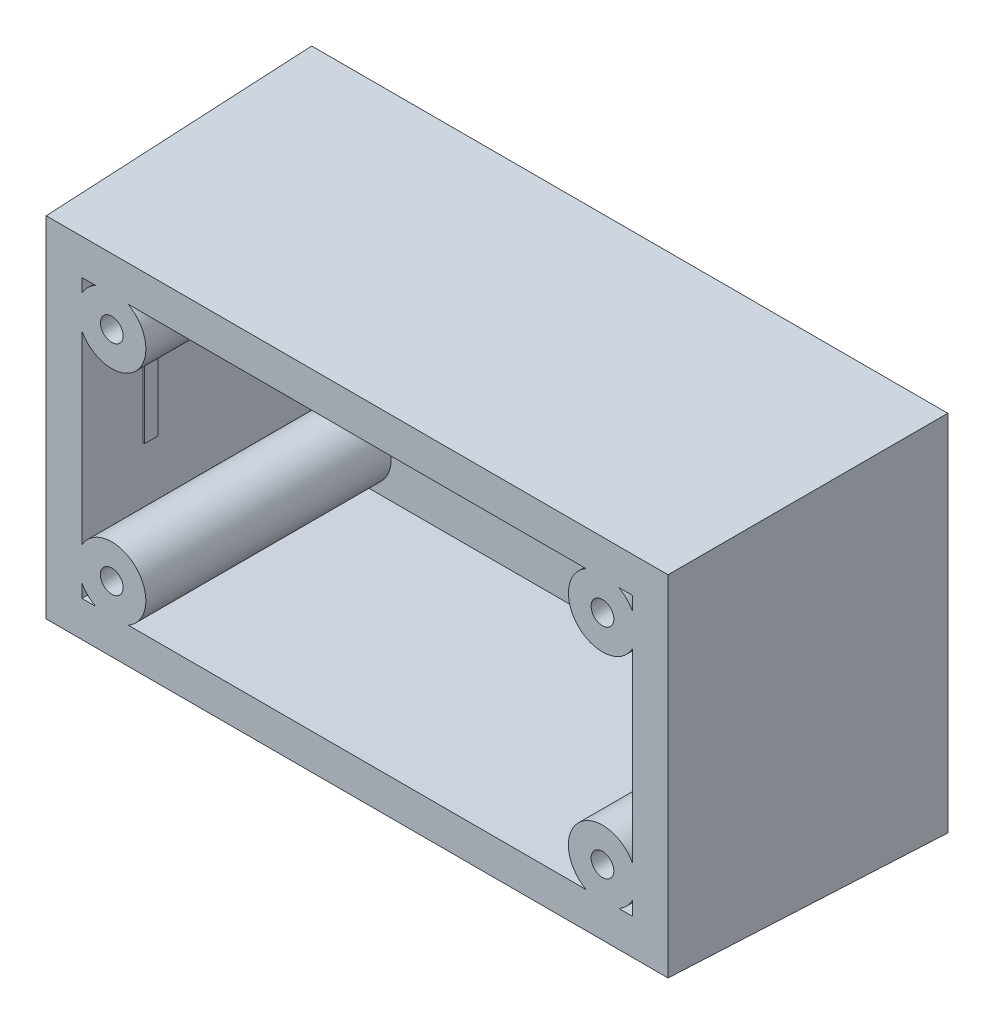
from build123d import *

# Parameters (mm, degrees)
SKETCH2_W                 = 70
SKETCH2_H                 = 40
DRAFTED_OUTER_SHELL_DEPTH = 30
DRAFTED_OUTER_SHELL_TAPER = 1.5
DRAFTED_CAVITY_START      = 3
SKETCH3_W                 = 62
SKETCH3_H                 = 32
DRAFTED_CAVITY_DEPTH      = 27
DRAFTED_CAVITY_TAPER      = 1.5
SCREW_BOSS_START          = 3
SKETCH4_R                 = 3.75
SCREW_BOSS_DEPTH          = 27
SCREW_BOSS_BORE_START     = 3
SKETCH5_R                 = 1.25
SCREW_BOSS_BORE_DEPTH     = 27
BOSS_EXTRUDE3_START       = 3
SKETCH6_R                 = 3.75
BOSS_EXTRUDE3_DEPTH       = 27
CUT_EXTRUDE3_START        = 3
SKETCH7_R                 = 1.25
CUT_EXTRUDE3_DEPTH        = 27
BOSS_EXTRUDE4_START       = 3
SKETCH8_R                 = 3.75
BOSS_EXTRUDE4_DEPTH       = 27
CUT_EXTRUDE4_START        = 3
SKETCH9_R                 = 1.25
CUT_EXTRUDE4_DEPTH        = 27
BOSS_EXTRUDE5_START       = 3
SKETCH10_R                = 3.75
BOSS_EXTRUDE5_DEPTH       = 27
CUT_EXTRUDE5_START        = 3
SKETCH11_R                = 1.25
CUT_EXTRUDE5_DEPTH        = 27
SNAP_CATCH_LEDGE_START    = 21.6
SKETCH12_W                = 2.107019882
SKETCH12_H                = 8
SNAP_CATCH_LEDGE_DEPTH    = 1.5
BOSS_EXTRUDE7_START       = 21.6
SKETCH13_W                = 2.107019882
SKETCH13_H                = 8
BOSS_EXTRUDE7_DEPTH       = 1.5


with BuildPart() as part:
    # Sketch2 → Drafted_outer_shell (new body)
    with BuildSketch(Plane.XY):
        Rectangle(SKETCH2_W, SKETCH2_H)
    extrude(amount=DRAFTED_OUTER_SHELL_DEPTH, taper=DRAFTED_OUTER_SHELL_TAPER)

    # Sketch3 → Drafted_cavity (cut)
    with BuildSketch(Plane.XY.offset(DRAFTED_CAVITY_START)):
        Rectangle(SKETCH3_W, SKETCH3_H)
    extrude(amount=DRAFTED_CAVITY_DEPTH, taper=DRAFTED_CAVITY_TAPER, mode=Mode.SUBTRACT)

    # Sketch4 → Screw_boss (add)
    with BuildSketch(Plane.XY.offset(SCREW_BOSS_START)):
        with Locations(Location((-27, -12, 0), (0, 0, 180))):
            Circle(SKETCH4_R)
    extrude(amount=SCREW_BOSS_DEPTH)

    # Sketch5 → Screw_boss_bore (cut)
    with BuildSketch(Plane.XY.offset(SCREW_BOSS_BORE_START)):
        with Locations((-27, -12)):
            Circle(SKETCH5_R)
    extrude(amount=SCREW_BOSS_BORE_DEPTH, mode=Mode.SUBTRACT)

    # Sketch6 → Boss-Extrude3 (add)
    with BuildSketch(Plane.XY.offset(BOSS_EXTRUDE3_START)):
        with Locations(Location((-27, 12, 0), (0, 0, 180))):
            Circle(SKETCH6_R)
    extrude(amount=BOSS_EXTRUDE3_DEPTH)

    # Sketch7 → Cut-Extrude3 (cut)
    with BuildSketch(Plane.XY.offset(CUT_EXTRUDE3_START)):
        with Locations((-27, 12)):
            Circle(SKETCH7_R)
    extrude(amount=CUT_EXTRUDE3_DEPTH, mode=Mode.SUBTRACT)

    # Sketch8 → Boss-Extrude4 (add)
    with BuildSketch(Plane.XY.offset(BOSS_EXTRUDE4_START)):
        with Locations(Location((27, -12, 0), (0, 0, 180))):
            Circle(SKETCH8_R)
    extrude(amount=BOSS_EXTRUDE4_DEPTH)

    # Sketch9 → Cut-Extrude4 (cut)
    with BuildSketch(Plane.XY.offset(CUT_EXTRUDE4_START)):
        with Locations((27, -12)):
            Circle(SKETCH9_R)
    extrude(amount=CUT_EXTRUDE4_DEPTH, mode=Mode.SUBTRACT)

    # Sketch10 → Boss-Extrude5 (add)
    with BuildSketch(Plane.XY.offset(BOSS_EXTRUDE5_START)):
        with Locations(Location((27, 12, 0), (0, 0, 180))):
            Circle(SKETCH10_R)
    extrude(amount=BOSS_EXTRUDE5_DEPTH)

    # Sketch11 → Cut-Extrude5 (cut)
    with BuildSketch(Plane.XY.offset(CUT_EXTRUDE5_START)):
        with Locations((27, 12)):
            Circle(SKETCH11_R)
    extrude(amount=CUT_EXTRUDE5_DEPTH, mode=Mode.SUBTRACT)

    # Sketch12 → Snap_catch_ledge (add)
    with BuildSketch(Plane.XY.offset(SNAP_CATCH_LEDGE_START)):
        with Locations((-31.346490059, 0)):
            Rectangle(SKETCH12_W, SKETCH12_H)
    extrude(amount=SNAP_CATCH_LEDGE_DEPTH)

    # Sketch13 → Boss-Extrude7 (add)
    with BuildSketch(Plane.XY.offset(BOSS_EXTRUDE7_START)):
        with Locations((31.346490059, 0)):
            Rectangle(SKETCH13_W, SKETCH13_H)
    extrude(amount=BOSS_EXTRUDE7_DEPTH)


solid = part.part
